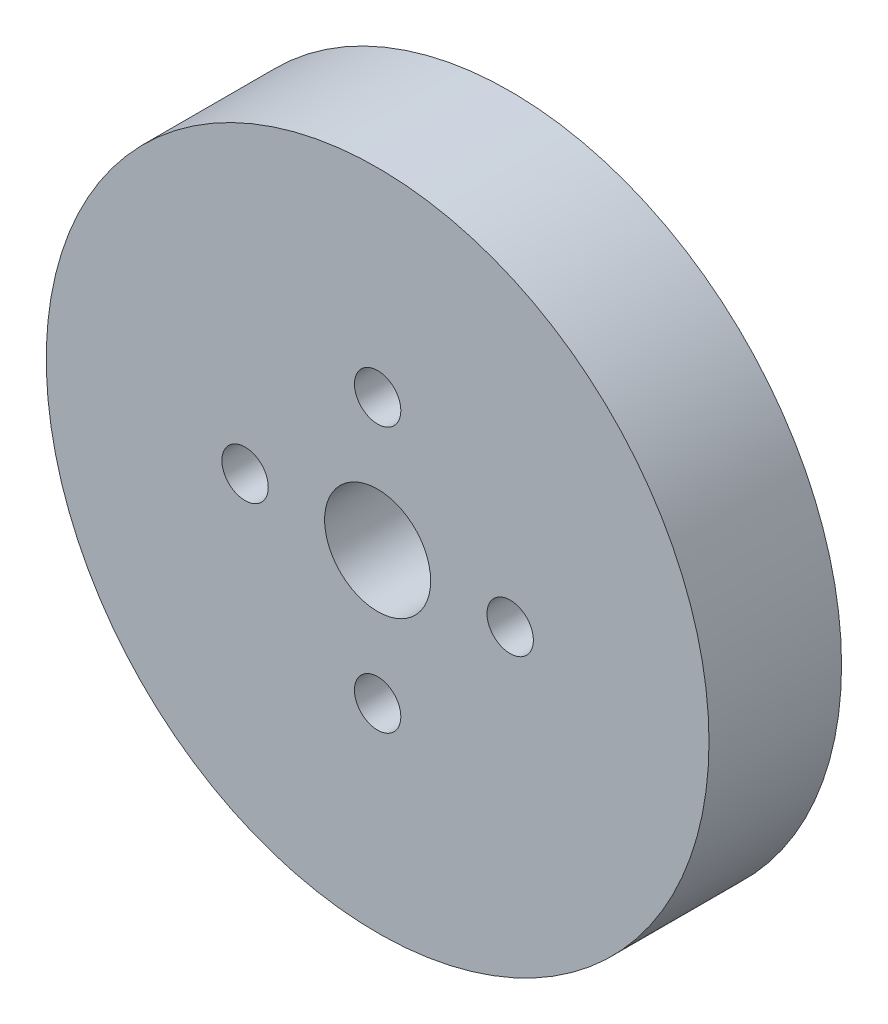
from build123d import *

# Parameters (mm, degrees)
SKETCH1_R           = 25
BOSS_EXTRUDE1_DEPTH = 10
SKETCH2_R           = 23
CUT_EXTRUDE1_DEPTH  = 2
SKETCH3_R           = 4
SKETCH3_R_2         = 1.75
CUT_EXTRUDE2_DEPTH  = 37.742346142
BOSS_EXTRUDE2_START = 2
BOSS_EXTRUDE2_DEPTH = 2
CIRPATTERN1_COUNT   = 20


with BuildPart() as part:
    # Sketch1 → Boss-Extrude1 (new body)
    with BuildSketch(Plane.XY):
        Circle(SKETCH1_R)
    extrude(amount=BOSS_EXTRUDE1_DEPTH)

    # Sketch2 → Cut-Extrude1 (cut)
    with BuildSketch(Plane(origin=(0, 0, 0), x_dir=(-1, 0, 0), z_dir=(0, 0, -1))):
        Circle(SKETCH2_R)
    extrude(amount=-CUT_EXTRUDE1_DEPTH, mode=Mode.SUBTRACT)

    # Sketch3 → Cut-Extrude2 (cut, through all)
    with BuildSketch(Plane.XY.offset(10)):
        Circle(SKETCH3_R)
        with Locations((10, 0)):
            Circle(SKETCH3_R_2)
        with Locations((0, -10)):
            Circle(SKETCH3_R_2)
        with Locations((-10, 0)):
            Circle(SKETCH3_R_2)
        with Locations((0, 10)):
            Circle(SKETCH3_R_2)
    extrude(amount=-CUT_EXTRUDE2_DEPTH, mode=Mode.SUBTRACT)

    # Sketch4 → Boss-Extrude2 (add)
    with BuildSketch(Plane(origin=(0, 0, 2), x_dir=(-1, 0, 0), z_dir=(0, 0, -1)).offset(BOSS_EXTRUDE2_START)):
        with BuildLine():
            Line((-0.75, 22.987768487), (-0.75, 18.464528853))
            Line((-0.75, 18.464528853), (0.75, 18.464528853))
            Line((0.75, 18.464528853), (0.75, 22.987768487))
            ThreePointArc((0.75, 22.987768487), (0, 23), (-0.75, 22.987768487))
        make_face()
    boss_extrude2 = extrude(amount=-BOSS_EXTRUDE2_DEPTH)

    # CirPattern1: Boss-Extrude2 ×20 about axis
    cirpattern1_axis = Axis((0, 0, 0), (0, 0, 1))
    for i in range(1, CIRPATTERN1_COUNT):
        add(boss_extrude2.rotate(cirpattern1_axis, i * 360 / CIRPATTERN1_COUNT))


solid = part.part
